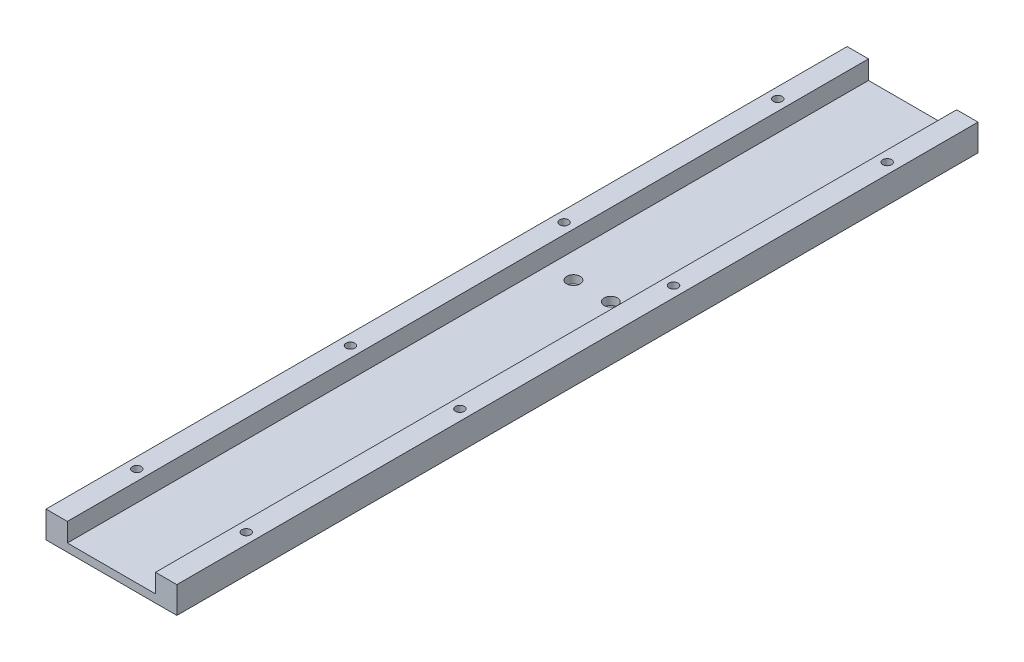
from build123d import *

# Parameters (mm, degrees)
BOSS_EXTRU_1_DEPTH           = 300
ENL_V_MAT_EXTRU_1_DEPTH      = 305.05591591
ENL_V_MAT_EXTRU_1_DEPTH_BACK = 305.05591591
ESQUISSE2_R                  = 2.5
ENL_V_MAT_EXTRU_2_DEPTH      = 305.1397705
ENL_V_MAT_EXTRU_2_DEPTH_BACK = 305.1397705
ESQUISSE3_R                  = 1.65


with BuildPart() as part:
    # Esquisse1 → Boss.-Extru.1 (new body)
    with BuildSketch(Plane.XY):
        Polygon((0, 0), (0, 10), (8, 10), (8, 3), (41, 3), (41, 10), (49, 10), (49, 0), align=None)
    extrude(amount=BOSS_EXTRU_1_DEPTH)

    # Esquisse2 → Enlèv. mat.-Extru.1 (cut, two sides: drawn at the far end of the back side and taken through both)
    with BuildSketch(Plane(origin=(0, 3, 0), x_dir=(1, 0, 0), z_dir=(0, 1, 0)).offset(-ENL_V_MAT_EXTRU_1_DEPTH_BACK)):
        with Locations(Location((17.5, -120, 0), (0, 0, 270))):
            Circle(ESQUISSE2_R)
        with Locations(Location((31.5, -120, 0), (0, 0, 90))):
            Circle(ESQUISSE2_R)
    extrude(amount=ENL_V_MAT_EXTRU_1_DEPTH + ENL_V_MAT_EXTRU_1_DEPTH_BACK, mode=Mode.SUBTRACT)

    # Esquisse3 → Enlèv. mat.-Extru.2 (cut, two sides: drawn at the far end of the back side and taken through both)
    with BuildSketch(Plane(origin=(0, 10, 0), x_dir=(1, 0, 0), z_dir=(0, 1, 0)).offset(-ENL_V_MAT_EXTRU_2_DEPTH_BACK)):
        with Locations(Location((45, -270, 0), (0, 0, 270))):
            Circle(ESQUISSE3_R)
        with Locations(Location((45, -190, 0), (0, 0, 270))):
            Circle(ESQUISSE3_R)
        with Locations(Location((45, -110, 0), (0, 0, 90))):
            Circle(ESQUISSE3_R)
        with Locations(Location((45, -30, 0), (0, 0, 90))):
            Circle(ESQUISSE3_R)
        with Locations(Location((4, -30, 0), (0, 0, 270))):
            Circle(ESQUISSE3_R)
        with Locations(Location((4, -110, 0), (0, 0, 270))):
            Circle(ESQUISSE3_R)
        with Locations(Location((4, -190, 0), (0, 0, 90))):
            Circle(ESQUISSE3_R)
        with Locations(Location((4, -270, 0), (0, 0, 90))):
            Circle(ESQUISSE3_R)
    extrude(amount=ENL_V_MAT_EXTRU_2_DEPTH + ENL_V_MAT_EXTRU_2_DEPTH_BACK, mode=Mode.SUBTRACT)


solid = part.part
